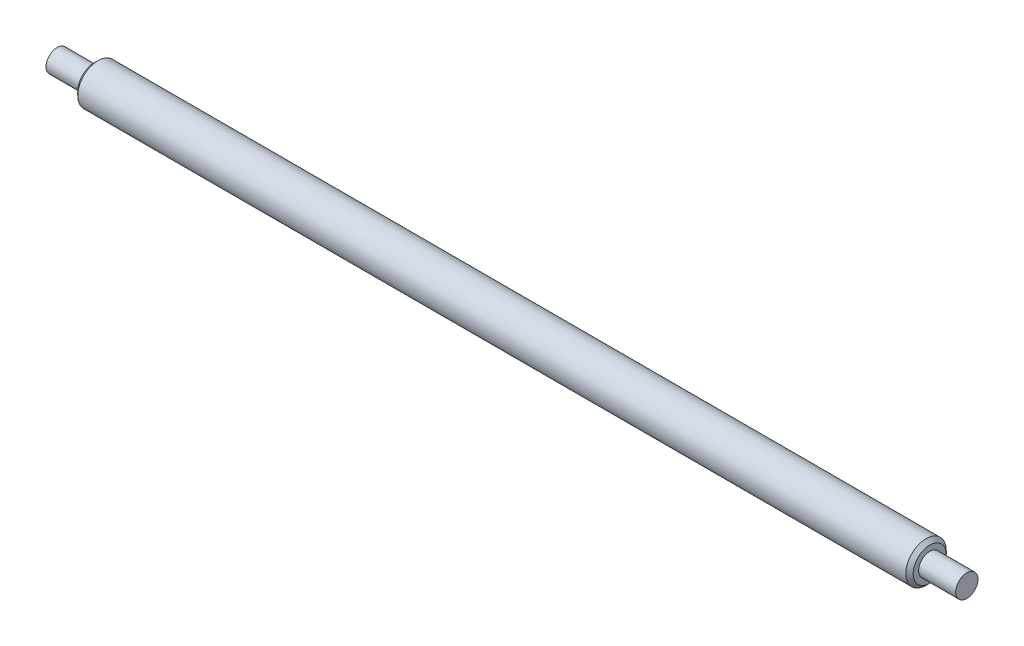
from build123d import *

# Parameters (mm, degrees)
SKETCH1_R           = 10.9
BOSS_EXTRUDE1_DEPTH = 245
SKETCH2_R           = 10.9
SKETCH2_R_2         = 6
CUT_EXTRUDE1_DEPTH  = 20
CUT_EXTRUDE2_START  = -20
SKETCH4_R           = 10.9
SKETCH4_R_2         = 6
CUT_EXTRUDE2_DEPTH  = 20
CHAMFER1_SIZE       = 2


with BuildPart() as part:
    # Sketch1 → Boss-Extrude1 (new, symmetric)
    with BuildSketch(Plane(origin=(0, 0, 0), x_dir=(0, 0, -1), z_dir=(1, 0, 0))):
        Circle(SKETCH1_R)
    extrude(amount=BOSS_EXTRUDE1_DEPTH, both=True)

    # Sketch2 → Cut-Extrude1 (cut)
    with BuildSketch(Plane(origin=(245, 0, 0), x_dir=(0, 0, -1), z_dir=(1, 0, 0))):
        Circle(SKETCH2_R)
        Circle(SKETCH2_R_2, mode=Mode.SUBTRACT)
    extrude(amount=-CUT_EXTRUDE1_DEPTH, mode=Mode.SUBTRACT)

    # Sketch4 → Cut-Extrude2 (cut)
    with BuildSketch(Plane.ZY.offset(245).offset(CUT_EXTRUDE2_START)):
        Circle(SKETCH4_R)
        with Locations(Location((0, 0, 0), (0, 0, 180))):
            Circle(SKETCH4_R_2, mode=Mode.SUBTRACT)
    extrude(amount=CUT_EXTRUDE2_DEPTH, mode=Mode.SUBTRACT)

    # Chamfer1
    chamfer1_edges = [part.edges().sort_by_distance(p)[0] for p in [
        (-225, 0, 10.9),
        (225, 0, 10.9),
    ]]
    chamfer(chamfer1_edges, length=CHAMFER1_SIZE)


solid = part.part
